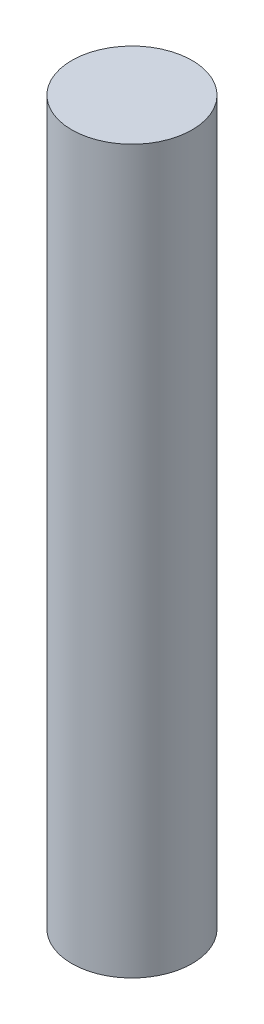
from build123d import *

# Parameters (mm, degrees)
SKETCH_1_R      = 2
EXTRUDE_1_DEPTH = 24


with BuildPart() as part:
    # 草图1 → 凸台-拉伸1 (new body)
    with BuildSketch(Plane(origin=(0, 0, 0), x_dir=(1, 0, 0), z_dir=(0, 1, 0))):
        with Locations(Location((0, 0, 0), (0, 0, 270))):
            Circle(SKETCH_1_R)
    extrude(amount=EXTRUDE_1_DEPTH)


solid = part.part
